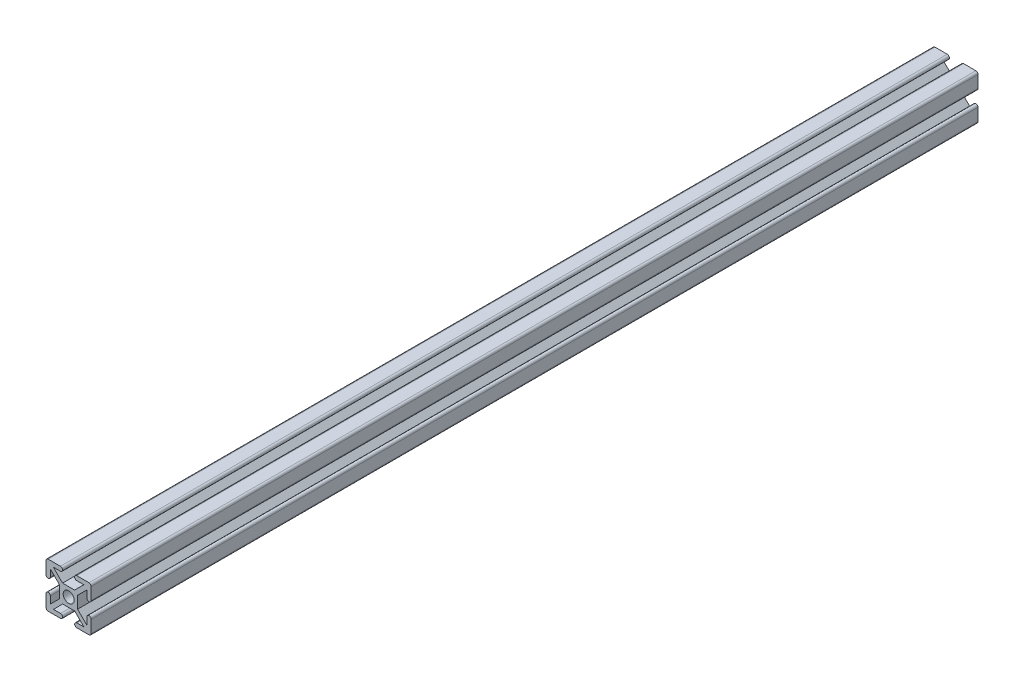
from build123d import *

# Parameters (mm, degrees)
CROQUIS1_R              = 3.645
SALIENTE_EXTRUIR1_DEPTH = 589.32


with BuildPart() as part:
    # Croquis1 → Saliente-Extruir1 (new body)
    with BuildSketch(Plane.XY):
        with BuildLine():
            Line((-14.465321263, -13.692119562), (-9.740321263, -13.692119562))
            Line((-9.740321263, -13.692119562), (-15.890321263, -7.542119562))
            Line((-15.890321263, -7.542119562), (-23.890321263, -7.542119562))
            Line((-23.890321263, -7.542119562), (-30.040321263, -13.692119562))
            Line((-30.040321263, -13.692119562), (-25.315321263, -13.692119562))
            ThreePointArc((-25.315321263, -13.692119562), (-23.890321263, -15.117119562), (-25.315321263, -16.542119562))
            Line((-25.315321263, -16.542119562), (-33.491757035, -16.515683789))
            ThreePointArc((-33.491757035, -16.515683789), (-34.480691284, -16.106053811), (-34.890321263, -15.117119562))
            Line((-34.890321263, -15.117119562), (-34.890321263, -6.967119562))
            ThreePointArc((-34.890321263, -6.967119562), (-33.491757035, -5.568555335), (-32.093192808, -6.967119562))
            Line((-32.093192808, -6.967119562), (-32.093192808, -11.692119562))
            Line((-32.093192808, -11.692119562), (-25.943192808, -5.542119562))
            Line((-25.943192808, -5.542119562), (-25.943192808, 2.457880438))
            Line((-25.943192808, 2.457880438), (-32.093192808, 8.607880438))
            Line((-32.093192808, 8.607880438), (-32.093192808, 3.882880438))
            ThreePointArc((-32.093192808, 3.882880438), (-33.518192808, 2.457880438), (-34.943192808, 3.882880438))
            Line((-34.943192808, 3.882880438), (-34.943192808, 12.032833848))
            ThreePointArc((-34.943192808, 12.032833848), (-34.525819971, 13.040461011), (-33.518192808, 13.457833848))
            Line((-33.518192808, 13.457833848), (-25.368192808, 13.457833848))
            ThreePointArc((-25.368192808, 13.457833848), (-23.943192808, 12.032833848), (-25.368192808, 10.607833848))
            Line((-25.368192808, 10.607833848), (-30.093192808, 10.607833848))
            Line((-30.093192808, 10.607833848), (-23.943192808, 4.457833848))
            Line((-23.943192808, 4.457833848), (-15.943192808, 4.457833848))
            Line((-15.943192808, 4.457833848), (-9.793192808, 10.607833848))
            Line((-9.793192808, 10.607833848), (-14.518192808, 10.607833848))
            ThreePointArc((-14.518192808, 10.607833848), (-15.943192808, 12.032833848), (-14.518192808, 13.457833848))
            Line((-14.518192808, 13.457833848), (-6.368192808, 13.457833848))
            ThreePointArc((-6.368192808, 13.457833848), (-5.360565645, 13.040461011), (-4.943192808, 12.032833848))
            Line((-4.943192808, 12.032833848), (-4.943192808, 3.986577533))
            ThreePointArc((-4.943192808, 3.986577533), (-6.368192808, 2.561577533), (-7.793192808, 3.986577533))
            Line((-7.793192808, 3.986577533), (-7.793192808, 8.607833848))
            Line((-7.793192808, 8.607833848), (-13.943192808, 2.457833848))
            Line((-13.943192808, 2.457833848), (-13.943192808, -5.542166152))
            Line((-13.943192808, -5.542166152), (-7.793192808, -11.692166152))
            Line((-7.793192808, -11.692166152), (-7.793192808, -6.863422467))
            ThreePointArc((-7.793192808, -6.863422467), (-6.368192808, -5.438422467), (-4.943192808, -6.863422467))
            Line((-4.943192808, -6.863422467), (-4.943192808, -15.117119562))
            ThreePointArc((-4.943192808, -15.117119562), (-5.360565645, -16.124746725), (-6.368192808, -16.542119562))
            Line((-6.368192808, -16.542119562), (-14.465321263, -16.542119562))
            ThreePointArc((-14.465321263, -16.542119562), (-15.890321263, -15.117119562), (-14.465321263, -13.692119562))
        make_face()
        with Locations((-19.890321263, -1.542119562)):
            Circle(CROQUIS1_R, mode=Mode.SUBTRACT)
    extrude(amount=SALIENTE_EXTRUIR1_DEPTH)


solid = part.part
